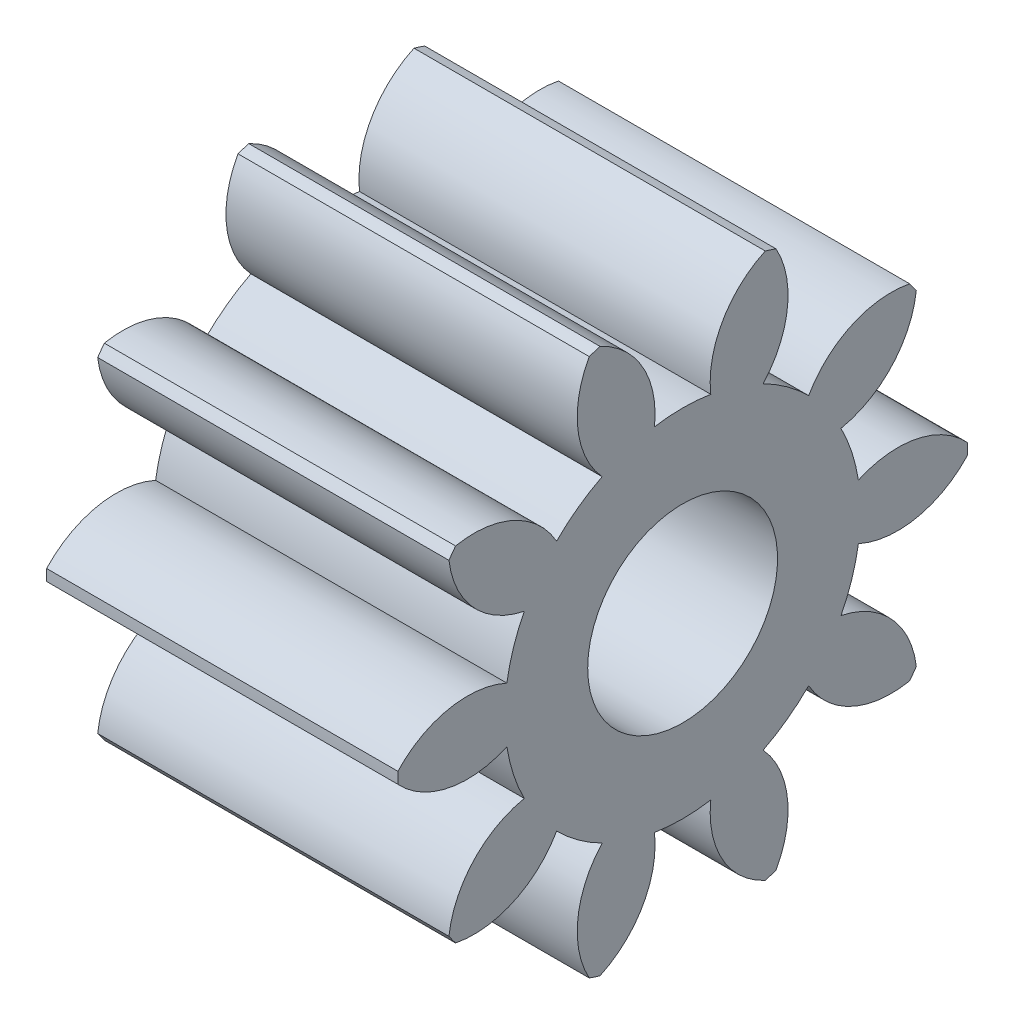
from build123d import *

# Parameters (mm, degrees)
BASPROSKE_W     = 3.7
BASPROSKE_H     = 3
TOOTHCUT_DEPTH  = 6.629387178
TEETHCUTS_COUNT = 10
TEETHCUTS_ANGLE = 324
BORSKE_R        = 1
BORE_DEPTH      = 50.0000508


with BuildPart() as part:
    # BasProSke → Base-Revolve (revolve)
    with BuildSketch(Plane(origin=(0, 0, 0), x_dir=(1, 0, 0), z_dir=(0, 1, 0)), mode=Mode.PRIVATE) as base_revolve_sk:
        with Locations((1.85, 1.5)):
            Rectangle(BASPROSKE_W, BASPROSKE_H)
    revolve(base_revolve_sk.sketch.rotate(Axis((-10, 0, 0), (1, 0, 0)), 180), axis=Axis((-10, 0, 0), (1, 0, 0)))

    # TooCutSke → ToothCut (cut, through all)
    with BuildSketch(Plane(origin=(0, 0, 0), x_dir=(0, 0, -1), z_dir=(1, 0, 0))):
        with BuildLine():
            ThreePointArc((0.296449938, 1.850403587), (0, 1.874), (-0.296449938, 1.850403587))
            ThreePointArc((-0.296449938, 1.850403587), (-0.428089565, 2.470295585), (-0.905889751, 2.886591228))
            ThreePointArc((-0.905889751, 2.886591228), (0, 3.0254), (0.905889751, 2.886591228))
            ThreePointArc((0.905889751, 2.886591228), (0.428089565, 2.470295585), (0.296449938, 1.850403587))
        make_face()
    toothcut = extrude(amount=TOOTHCUT_DEPTH, mode=Mode.SUBTRACT)

    # TeethCuts: ToothCut ×10 about axis
    teethcuts_axis = Axis((-10, 0, 0), (1, 0, 0))
    for i in range(1, TEETHCUTS_COUNT):
        add(toothcut.rotate(teethcuts_axis, i * TEETHCUTS_ANGLE / (TEETHCUTS_COUNT - 1)), mode=Mode.SUBTRACT)

    # BorSke → Bore (cut, symmetric)
    with BuildSketch(Plane(origin=(0, 0, 0), x_dir=(0, 0, -1), z_dir=(1, 0, 0))):
        with Locations(Location((0, 0, 0), (0, 0, 180))):
            Circle(BORSKE_R)
    extrude(amount=BORE_DEPTH, both=True, mode=Mode.SUBTRACT)


solid = part.part
